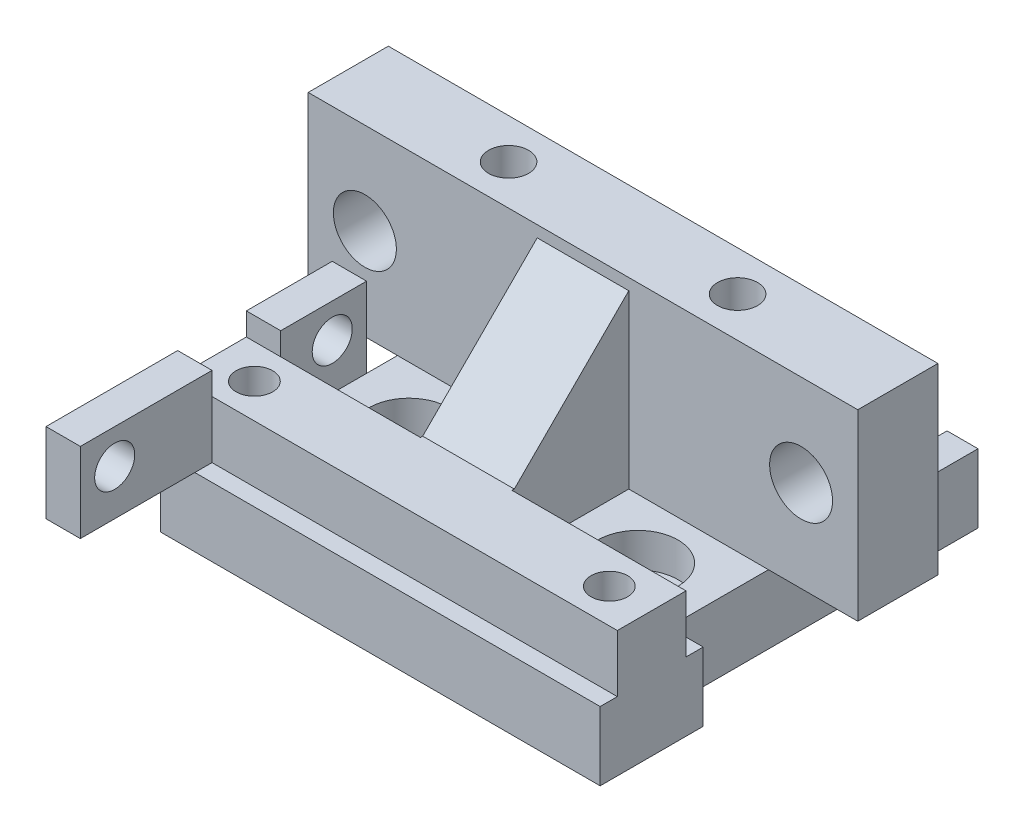
from build123d import *

# Parameters (mm, degrees)
SKETCH_1_R          = 1.6
EXTRUDE_1_DEPTH     = 6
SKETCH_2_R          = 3.5
CUT_EXTRUDE_1_DEPTH = 3
SKETCH_3_W          = 48
SKETCH_3_H          = 7
EXTRUDE_2_DEPTH     = 16
SKETCH_5_R          = 2.75
CUT_EXTRUDE_2_DEPTH = 7
SKETCH_6_R          = 1.6
EXTRUDE_3_DEPTH     = 5
SKETCH_7_R          = 1.75
EXTRUDE_4_DEPTH     = 3
CHAMFER_1_SIZE      = 10
CUT_EXTRUDE_START   = -11
SKETCH_8_R          = 1.6
CUT_EXTRUDE_3_DEPTH = 11
SKETCH_9_R          = 1.75
CUT_EXTRUDE_4_DEPTH = 7


with BuildPart() as part:
    # Эскиз1 → Бобышка-Вытянуть1 (new body)
    with BuildSketch(Plane(origin=(0, 0, 0), x_dir=(1, 0, 0), z_dir=(0, 1, 0))):
        Polygon((0, 0), (0, 27), (32.4, 27), (32.4, 0), (35.4, 0), (35.4, -9), (-3, -9), (-3, 0), align=None)
        with Locations(Location((6.2, 23.5, 0), (0, 0, 270))):
            Circle(SKETCH_1_R, mode=Mode.SUBTRACT)
        with Locations(Location((26.2, 23.5, 0), (0, 0, 270))):
            Circle(SKETCH_1_R, mode=Mode.SUBTRACT)
        with Locations(Location((6.2, 3.5, 0), (0, 0, 270))):
            Circle(SKETCH_1_R, mode=Mode.SUBTRACT)
        with Locations(Location((26.2, 3.5, 0), (0, 0, 270))):
            Circle(SKETCH_1_R, mode=Mode.SUBTRACT)
        with Locations(Location((31.7, -4.5, 0), (0, 0, 270))):
            Circle(SKETCH_1_R, mode=Mode.SUBTRACT)
        with Locations(Location((0.7, -4.5, 0), (0, 0, 270))):
            Circle(SKETCH_1_R, mode=Mode.SUBTRACT)
    extrude(amount=EXTRUDE_1_DEPTH)

    # Эскиз2 → Вырез-Вытянуть1 (cut)
    with BuildSketch(Plane(origin=(0, 6, 0), x_dir=(1, 0, 0), z_dir=(0, 1, 0))):
        with Locations(Location((26.2, 3.5, 0), (0, 0, 270))):
            Circle(SKETCH_2_R)
        with Locations(Location((6.2, 3.5, 0), (0, 0, 270))):
            Circle(SKETCH_2_R)
        with BuildLine():
            Line((29.7, 23.5), (29.7, 27))
            Line((29.7, 27), (22.7, 27))
            Line((22.7, 27), (22.7, 23.5))
            ThreePointArc((22.7, 23.5), (26.2, 20), (29.7, 23.5))
        make_face()
        with BuildLine():
            Line((9.7, 23.5), (9.7, 27))
            Line((9.7, 27), (2.7, 27))
            Line((2.7, 27), (2.7, 23.5))
            ThreePointArc((2.7, 23.5), (6.2, 20), (9.7, 23.5))
        make_face()
    extrude(amount=-CUT_EXTRUDE_1_DEPTH, mode=Mode.SUBTRACT)

    # Эскиз3 → Бобышка-Вытянуть2 (add)
    with BuildSketch(Plane(origin=(0, 6, 0), x_dir=(1, 0, 0), z_dir=(0, 1, 0))):
        with Locations((16.2, 12.2)):
            Rectangle(SKETCH_3_W, SKETCH_3_H)
    extrude(amount=EXTRUDE_2_DEPTH)

    # Эскиз5 → Вырез-Вытянуть2 (cut)
    with BuildSketch(Plane(origin=(0, 0, -15.7), x_dir=(-1, 0, 0), z_dir=(0, 0, -1))):
        with Locations((-35.25, 14)):
            Circle(SKETCH_5_R)
        with Locations((2.85, 14)):
            Circle(SKETCH_5_R)
    extrude(amount=-CUT_EXTRUDE_2_DEPTH, mode=Mode.SUBTRACT)

    # Эскиз6 → Бобышка-Вытянуть3 (add)
    with BuildSketch(Plane(origin=(0, 6, 0), x_dir=(1, 0, 0), z_dir=(0, 1, 0))):
        Polygon((35.4, -7.5), (-3, -7.5), (-3, -1.5), (12.2, -1.5), (12.2, 8.7), (20.2, 8.7), (20.2, -1.5), (35.4, -1.5), align=None)
        with Locations(Location((31.7, -4.5, 0), (0, 0, 270))):
            Circle(SKETCH_6_R, mode=Mode.SUBTRACT)
        with Locations(Location((0.7, -4.5, 0), (0, 0, 270))):
            Circle(SKETCH_6_R, mode=Mode.SUBTRACT)
    extrude(amount=EXTRUDE_3_DEPTH)

    # Эскиз7 → Бобышка-Вытянуть4 (add)
    with BuildSketch(Plane.ZY):
        Polygon((7.5, 12.97640534), (18.99998535, 12.97640534), (18.99998535, 6), (9, 6), (9, 0), (-6, 0), (-6, 12.97640534), (1.5, 12.97640534), (1.5, 11), (7.5, 11), align=None)
        with Locations((-3, 10)):
            Circle(SKETCH_7_R, mode=Mode.SUBTRACT)
        with Locations((15.99998535, 9.97640534)):
            Circle(SKETCH_7_R, mode=Mode.SUBTRACT)
    extrude(amount=EXTRUDE_4_DEPTH)

    # Фаска1
    chamfer_1_edges = [part.edges().sort_by_distance(p)[0] for p in [
        (16.2, 11, -8.7),
    ]]
    chamfer(chamfer_1_edges, length=CHAMFER_1_SIZE)

    # Эскиз8 → Вырез-Вытянуть3 (cut)
    with BuildSketch(Plane(origin=(0, 11, 0), x_dir=(1, 0, 0), z_dir=(0, 1, 0)).offset(CUT_EXTRUDE_START)):
        with Locations(Location((0.7, -4.5, 0), (0, 0, 270))):
            Circle(SKETCH_8_R)
    extrude(amount=CUT_EXTRUDE_3_DEPTH, mode=Mode.SUBTRACT)

    # Эскиз9 → Вырез-Вытянуть4 (cut)
    with BuildSketch(Plane(origin=(0, 22, 0), x_dir=(1, 0, 0), z_dir=(0, 1, 0))):
        with Locations(Location((26.2, 12.2, 0), (0, 0, 270))):
            Circle(SKETCH_9_R)
        with Locations(Location((6.2, 12.2, 0), (0, 0, 270))):
            Circle(SKETCH_9_R)
    extrude(amount=-CUT_EXTRUDE_4_DEPTH, mode=Mode.SUBTRACT)


solid = part.part
